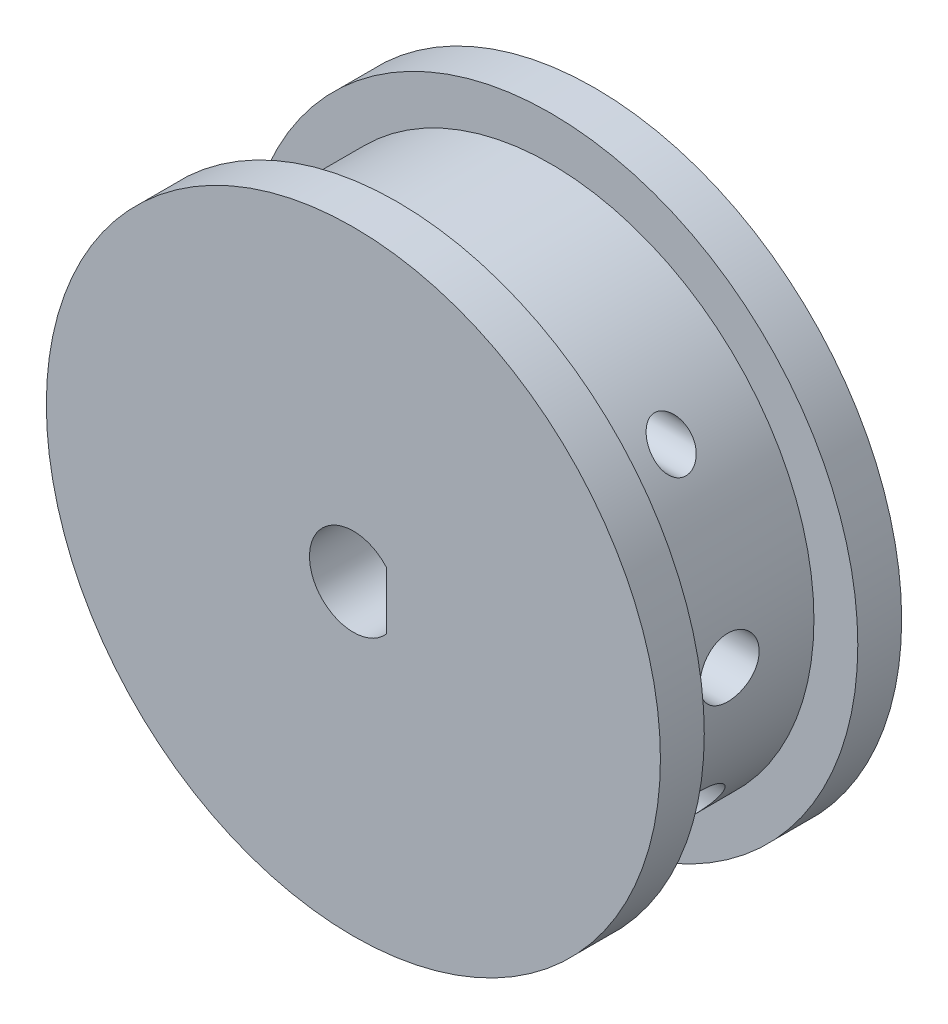
from build123d import *
from build123d.topology import SkipClean

# Parameters (mm, degrees)
SKETCH1_R                                           = 12
SKETCH1_R_2                                         = 2
SQUARE_BODY_DEPTH                                   = 11
CBORE_FOR_0_BINDING_HEAD_MACHINE_SCREW1_D           = 1.778
CBORE_FOR_0_BINDING_HEAD_MACHINE_SCREW1_CBORE_D     = 3.97002
CBORE_FOR_0_BINDING_HEAD_MACHINE_SCREW1_CBORE_DEPTH = 4.812792
CBORE_FOR_0_BINDING_HEAD_MACHINE_SC_2_D             = 1.778
CBORE_FOR_0_BINDING_HEAD_MACHINE_SC_2_CBORE_D       = 3.97002
CBORE_FOR_0_BINDING_HEAD_MACHINE_SC_2_CBORE_DEPTH   = 4.812792
F_6_32_TAPPED_HOLE2_D                               = 2.7051
F_6_32_TAPPED_HOLE2_DEPTH                           = 10.5
CENTER_SPINDLE_DEPTH                                = 21.223748416
SKETCH1_3_R                                         = 14
SKETCH1_3_R_2                                       = 12
TOP_FLANGE_DEPTH                                    = 2
BOTTOM_START                                        = 9
SKETCH1_4_R                                         = 14
SKETCH1_4_R_2                                       = 12
BOTTOM_FLANGE_DEPTH                                 = 2


with BuildPart() as part:
    # Sketch1 → Square Body (new body)
    # profile 1 of 10: a face of its own
    with BuildSketch(Plane.XY):
        Circle(SKETCH1_R)
        Circle(SKETCH1_R_2, mode=Mode.SUBTRACT)
    # profile 2 of 10: a face of its own
    with BuildSketch(Plane.XY):
        with BuildLine():
            Line((-12, 7.211102551), (-12, 0))
            ThreePointArc((-12, 0), (-8.485281374, 8.485281374), (0, 12))
            Line((0, 12), (-7.211102551, 12))
            ThreePointArc((-7.211102551, 12), (-9.899494937, 9.899494937), (-12, 7.211102551))
        make_face()
    # profile 3 of 10: a face of its own
    with BuildSketch(Plane.XY):
        with BuildLine():
            Line((-12, 12), (-12, 7.211102551))
            ThreePointArc((-12, 7.211102551), (-9.899494937, 9.899494937), (-7.211102551, 12))
            Line((-7.211102551, 12), (-12, 12))
        make_face()
    # profile 4 of 10: a face of its own
    with BuildSketch(Plane.XY):
        with BuildLine():
            ThreePointArc((0, -12), (-8.485281374, -8.485281374), (-12, 0))
            Line((-12, 0), (-12, -7.211102551))
            ThreePointArc((-12, -7.211102551), (-9.899494937, -9.899494937), (-7.211102551, -12))
            Line((-7.211102551, -12), (0, -12))
        make_face()
    # profile 5 of 10: a face of its own
    with BuildSketch(Plane.XY):
        with BuildLine():
            ThreePointArc((-7.211102551, -12), (-9.899494937, -9.899494937), (-12, -7.211102551))
            Line((-12, -7.211102551), (-12, -12))
            Line((-12, -12), (-7.211102551, -12))
        make_face()
    # profile 6 of 10: a face of its own
    with BuildSketch(Plane.XY):
        with BuildLine():
            ThreePointArc((12, 0), (8.485281374, -8.485281374), (0, -12))
            Line((0, -12), (7.211102551, -12))
            ThreePointArc((7.211102551, -12), (9.899494937, -9.899494937), (12, -7.211102551))
            Line((12, -7.211102551), (12, 0))
        make_face()
    # profile 7 of 10: a face of its own
    with BuildSketch(Plane.XY):
        with BuildLine():
            ThreePointArc((12, -7.211102551), (9.899494937, -9.899494937), (7.211102551, -12))
            Line((7.211102551, -12), (12, -12))
            Line((12, -12), (12, -7.211102551))
        make_face()
    # profile 8 of 10: a face of its own
    with BuildSketch(Plane.XY):
        with BuildLine():
            Line((7.211102551, 12), (0, 12))
            ThreePointArc((0, 12), (8.485281374, 8.485281374), (12, 0))
            Line((12, 0), (12, 7.211102551))
            ThreePointArc((12, 7.211102551), (9.899494937, 9.899494937), (7.211102551, 12))
        make_face()
    # profile 9 of 10: a face of its own
    with BuildSketch(Plane.XY):
        with BuildLine():
            Line((12, 12), (7.211102551, 12))
            ThreePointArc((7.211102551, 12), (9.899494937, 9.899494937), (12, 7.211102551))
            Line((12, 7.211102551), (12, 12))
        make_face()
    # profile 10 of 10: a face of its own
    with BuildSketch(Plane.XY):
        with BuildLine():
            ThreePointArc((2, 0), (1.870828693, 0.707106781), (1.5, 1.322875656))
            Line((1.5, 1.322875656), (1.5, -1.322875656))
            ThreePointArc((1.5, -1.322875656), (1.870828693, -0.707106781), (2, 0))
        make_face()
    extrude(amount=SQUARE_BODY_DEPTH)

    # CBORE for #0 Binding Head Machine Screw1 (through all)
    with Locations(Plane(origin=(-12, 7.5, 5.85), x_dir=(0, -1, 0), z_dir=(-1, 0, 0))):
        with Locations((0, 0)):
            CounterBoreHole(CBORE_FOR_0_BINDING_HEAD_MACHINE_SCREW1_D / 2, CBORE_FOR_0_BINDING_HEAD_MACHINE_SCREW1_CBORE_D / 2, CBORE_FOR_0_BINDING_HEAD_MACHINE_SCREW1_CBORE_DEPTH)

    # CBORE for _0 Binding Head Machine Sc 2 (through all)
    with Locations(Plane(origin=(12, -7.5, 5.85), x_dir=(0, 0, 1), z_dir=(1, 0, 0))):
        with Locations((0, 0)):
            CounterBoreHole(CBORE_FOR_0_BINDING_HEAD_MACHINE_SC_2_D / 2, CBORE_FOR_0_BINDING_HEAD_MACHINE_SC_2_CBORE_D / 2, CBORE_FOR_0_BINDING_HEAD_MACHINE_SC_2_CBORE_DEPTH)

    # #6-32 Tapped Hole2
    with Locations(Plane(origin=(12, 0, 5.85), x_dir=(0, 1, 0), z_dir=(1, 0, 0))):
        with Locations((0, 0)):
            Hole(F_6_32_TAPPED_HOLE2_D / 2, depth=F_6_32_TAPPED_HOLE2_DEPTH)

    # Sketch1<5> → Center Spindle (cut, through all)
    with SkipClean():  # the faces are left unmerged after this step: merging them gives an invalid solid
        with BuildSketch(Plane.XY):
            with BuildLine():
                ThreePointArc((0, -12), (-8.485281374, -8.485281374), (-12, 0))
                Line((-12, 0), (-12, -7.211102551))
                ThreePointArc((-12, -7.211102551), (-9.899494937, -9.899494937), (-7.211102551, -12))
                Line((-7.211102551, -12), (0, -12))
            make_face()
            with BuildLine():
                ThreePointArc((-7.211102551, -12), (-9.899494937, -9.899494937), (-12, -7.211102551))
                Line((-12, -7.211102551), (-12, -12))
                Line((-12, -12), (-7.211102551, -12))
            make_face()
            with BuildLine():
                Line((-12, 7.211102551), (-12, 0))
                ThreePointArc((-12, 0), (-8.485281374, 8.485281374), (0, 12))
                Line((0, 12), (-7.211102551, 12))
                ThreePointArc((-7.211102551, 12), (-9.899494937, 9.899494937), (-12, 7.211102551))
            make_face()
            with BuildLine():
                Line((-12, 12), (-12, 7.211102551))
                ThreePointArc((-12, 7.211102551), (-9.899494937, 9.899494937), (-7.211102551, 12))
                Line((-7.211102551, 12), (-12, 12))
            make_face()
            with BuildLine():
                Line((7.211102551, 12), (0, 12))
                ThreePointArc((0, 12), (8.485281374, 8.485281374), (12, 0))
                Line((12, 0), (12, 7.211102551))
                ThreePointArc((12, 7.211102551), (9.899494937, 9.899494937), (7.211102551, 12))
            make_face()
            with BuildLine():
                Line((12, 12), (7.211102551, 12))
                ThreePointArc((7.211102551, 12), (9.899494937, 9.899494937), (12, 7.211102551))
                Line((12, 7.211102551), (12, 12))
            make_face()
            with BuildLine():
                ThreePointArc((12, 0), (8.485281374, -8.485281374), (0, -12))
                Line((0, -12), (7.211102551, -12))
                ThreePointArc((7.211102551, -12), (9.899494937, -9.899494937), (12, -7.211102551))
                Line((12, -7.211102551), (12, 0))
            make_face()
            with BuildLine():
                ThreePointArc((12, -7.211102551), (9.899494937, -9.899494937), (7.211102551, -12))
                Line((7.211102551, -12), (12, -12))
                Line((12, -12), (12, -7.211102551))
            make_face()
        extrude(amount=CENTER_SPINDLE_DEPTH, mode=Mode.SUBTRACT)

    # Sketch1<3> → Top Flange (add)
    with SkipClean():  # the faces are left unmerged after this step: merging them gives an invalid solid
        with BuildSketch(Plane.XY):
            Circle(SKETCH1_3_R)
            Circle(SKETCH1_3_R_2, mode=Mode.SUBTRACT)
        extrude(amount=TOP_FLANGE_DEPTH)

    # Sketch1<4> → Bottom Flange (add)
    with SkipClean():  # the faces are left unmerged after this step: merging them gives an invalid solid
        with BuildSketch(Plane.XY.offset(BOTTOM_START)):
            Circle(SKETCH1_4_R)
            Circle(SKETCH1_4_R_2, mode=Mode.SUBTRACT)
        extrude(amount=BOTTOM_FLANGE_DEPTH)


solid = part.part
